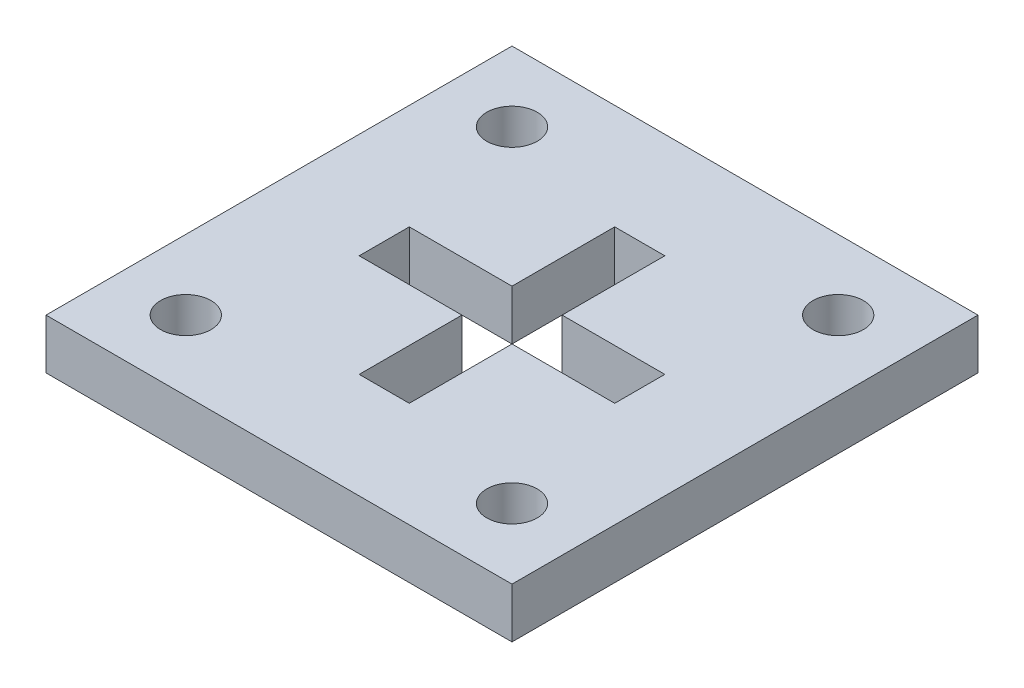
from build123d import *

# Parameters (mm, degrees)
SKETCH1_W            = 50.8
SKETCH1_H            = 50.8
BOSS_EXTRUDE1_DEPTH  = 5.461
CUT_EXTRUDE1_DEPTH   = 5.461
M5_CLEARANCE_HOLE1_D = 5.5


with BuildPart() as part:
    # Sketch1 → Boss-Extrude1 (new body)
    with BuildSketch(Plane(origin=(0, 0, 0), x_dir=(1, 0, 0), z_dir=(0, 1, 0))):
        with Locations((25.4, 25.4)):
            Rectangle(SKETCH1_W, SKETCH1_H)
    extrude(amount=BOSS_EXTRUDE1_DEPTH)

    # Sketch2 → Cut-Extrude1 (cut)
    with BuildSketch(Plane(origin=(0, 5.461, 0), x_dir=(1, 0, 0), z_dir=(0, 1, 0))):
        Polygon((28.1305, 28.1305), (39.327666667, 28.1305), (39.327666667, 22.6695), (28.1305, 22.6695), (28.1305, 11.472333333), (22.6695, 11.472333333), (22.6695, 22.6695), (11.472333333, 22.6695), (11.472333333, 28.1305), (22.6695, 28.1305), (22.6695, 39.327666667), (28.1305, 39.327666667), align=None)
    extrude(amount=-CUT_EXTRUDE1_DEPTH, mode=Mode.SUBTRACT)

    # M5 Clearance Hole1 (through all)
    with Locations(Plane(origin=(0, 5.461, 0), x_dir=(1, 0, 0), z_dir=(0, 1, 0))):
        with Locations((7.62, 43.18), (43.18, 43.18), (43.18, 7.62), (7.62, 7.62)):
            Hole(M5_CLEARANCE_HOLE1_D / 2)


solid = part.part
